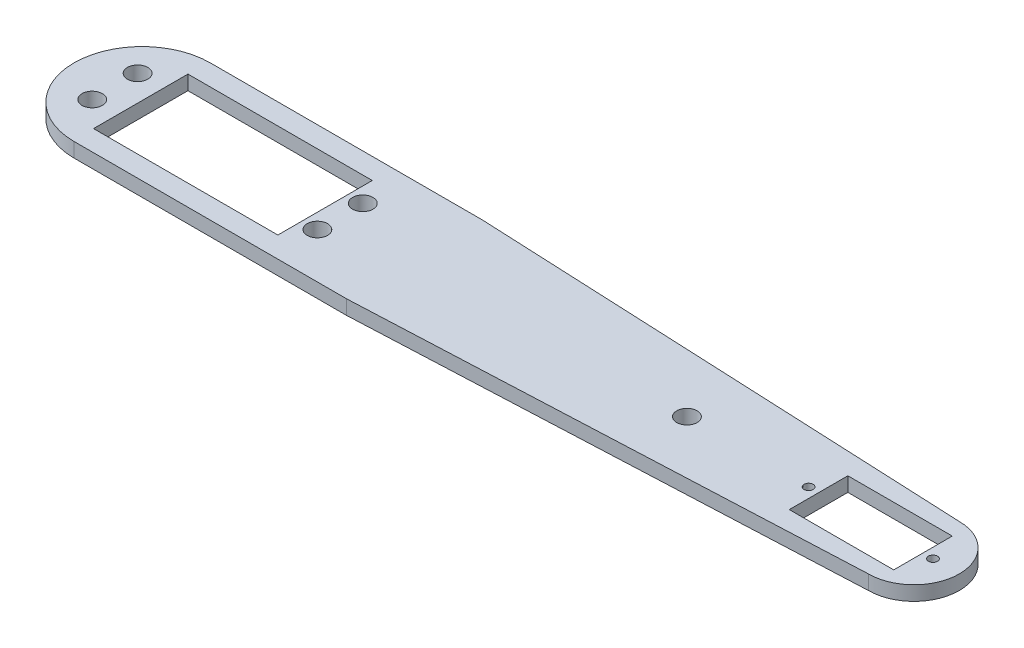
from build123d import *

# Parameters (mm, degrees)
SKETCH1_R           = 2.25
SKETCH1_R_2         = 1
SKETCH1_W           = 40.6
SKETCH1_H           = 20.8
SKETCH1_W_2         = 23
SKETCH1_H_2         = 12.9
BOSS_EXTRUDE1_DEPTH = 3.175


with BuildPart() as part:
    # Sketch1 → Boss-Extrude1 (new body)
    with BuildSketch(Plane(origin=(0, 0, 0), x_dir=(1, 0, 0), z_dir=(0, 1, 0))):
        with BuildLine():
            Line((-162.38735588, 17.244652891), (-102.38735588, 17.244652891))
            Line((-102.38735588, 17.244652891), (7.61264412, 12.244652891))
            ThreePointArc((7.61264412, 12.244652891), (17.61264412, 2.244652891), (7.61264412, -7.755347109))
            Line((7.61264412, -7.755347109), (-102.38735588, -12.755347109))
            Line((-102.38735588, -12.755347109), (-162.38735588, -12.755347109))
            ThreePointArc((-162.38735588, -12.755347109), (-177.38735588, 2.244652891), (-162.38735588, 17.244652891))
        make_face()
        with Locations(Location((-168.38735588, 7.244652891, 0), (0, 0, 270))):
            Circle(SKETCH1_R, mode=Mode.SUBTRACT)
        with Locations(Location((-168.38735588, -2.755347109, 0), (0, 0, 270))):
            Circle(SKETCH1_R, mode=Mode.SUBTRACT)
        with Locations(Location((-118.78735588, 7.244652891, 0), (0, 0, 270))):
            Circle(SKETCH1_R, mode=Mode.SUBTRACT)
        with Locations(Location((-118.78735588, -2.755347109, 0), (0, 0, 270))):
            Circle(SKETCH1_R, mode=Mode.SUBTRACT)
        with Locations(Location((-15.58735588, 2.244652891, 0), (0, 0, 270))):
            Circle(SKETCH1_R_2, mode=Mode.SUBTRACT)
        with Locations(Location((11.81264412, 2.244652891, 0), (0, 0, 270))):
            Circle(SKETCH1_R_2, mode=Mode.SUBTRACT)
        with Locations(Location((-42.38735588, 2.244652891, 0), (0, 0, 270))):
            Circle(SKETCH1_R, mode=Mode.SUBTRACT)
        with Locations((-142.392621679, 2.244652891)):
            Rectangle(SKETCH1_W, SKETCH1_H, mode=Mode.SUBTRACT)
        with Locations((-1.88735588, 2.244652891)):
            Rectangle(SKETCH1_W_2, SKETCH1_H_2, mode=Mode.SUBTRACT)
    extrude(amount=BOSS_EXTRUDE1_DEPTH)


solid = part.part
